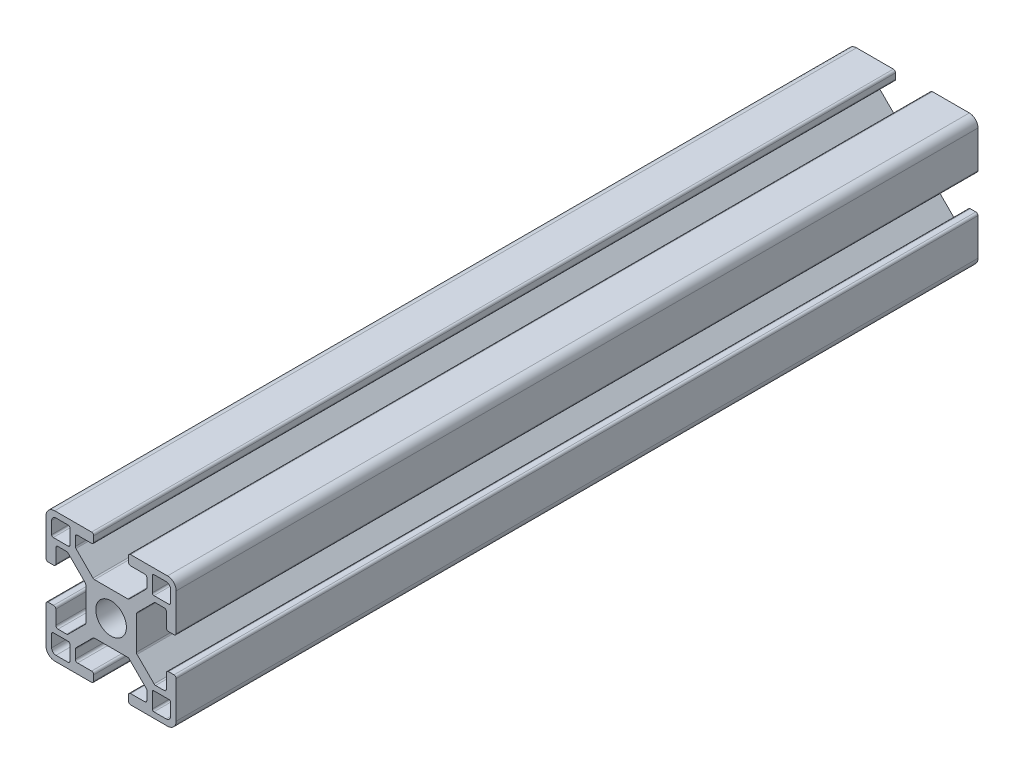
from build123d import *

# Parameters (mm, degrees)
SKETCH1_R           = 3.52998588
BOSS_EXTRUDE1_DEPTH = 92.4


with BuildPart() as part:
    # Sketch1 → Boss-Extrude1 (new, symmetric)
    with BuildSketch(Plane.XY):
        with BuildLine():
            Line((14.49994, -4), (13.24247465, -4))
            ThreePointArc((13.24247465, -4), (12.88892126, -4.146446609), (12.74247465, -4.5))
            Line((12.74247465, -4.5), (12.74247465, -7.732519321))
            ThreePointArc((12.74247465, -7.732519321), (12.602449697, -8.097296796), (12.242781236, -8.249967))
            Line((12.242781236, -8.249967), (10.260188032, -8.249967))
            ThreePointArc((10.260188032, -8.249967), (10.068847082, -8.211906919), (9.906636056, -8.103520976))
            Line((9.906636056, -8.103520976), (5.981117769, -4.178002689))
            ThreePointArc((5.981117769, -4.178002689), (5.872731827, -4.015791664), (5.834671745, -3.824450713))
            Line((5.834671745, -3.824450713), (5.834671745, -1.01249595))
            Line((5.834671745, -1.01249595), (5.834671745, 0.88749645))
            Line((5.834671745, 0.88749645), (5.834671745, 3.824450713))
            ThreePointArc((5.834671745, 3.824450713), (5.872731827, 4.015791664), (5.981117769, 4.178002689))
            Line((5.981117769, 4.178002689), (9.906636056, 8.103520976))
            ThreePointArc((9.906636056, 8.103520976), (10.068847082, 8.211906919), (10.260188032, 8.249967))
            Line((10.260188032, 8.249967), (12.242781236, 8.249967))
            ThreePointArc((12.242781236, 8.249967), (12.602449697, 8.097296796), (12.74247465, 7.732519321))
            Line((12.74247465, 7.732519321), (12.74247465, 4.5))
            ThreePointArc((12.74247465, 4.5), (12.88892126, 4.146446609), (13.24247465, 4))
            Line((13.24247465, 4), (14.49994, 4))
            ThreePointArc((14.49994, 4), (14.853493391, 4.146446609), (14.99994, 4.5))
            Line((14.99994, 4.5), (14.99994, 12.999948))
            ThreePointArc((14.99994, 12.999948), (14.414155906, 14.414155906), (12.999948, 14.99994))
            Line((12.999948, 14.99994), (4.5, 14.99994))
            ThreePointArc((4.5, 14.99994), (4.146446609, 14.853493391), (4, 14.49994))
            Line((4, 14.49994), (4, 13.24247465))
            ThreePointArc((4, 13.24247465), (4.146446609, 12.88892126), (4.5, 12.74247465))
            Line((4.5, 12.74247465), (7.732519321, 12.74247465))
            ThreePointArc((7.732519321, 12.74247465), (8.097296796, 12.602449697), (8.249967, 12.242781236))
            Line((8.249967, 12.242781236), (8.249967, 10.260188032))
            ThreePointArc((8.249967, 10.260188032), (8.211906919, 10.068847082), (8.103520976, 9.906636056))
            Line((8.103520976, 9.906636056), (4.178002689, 5.981117769))
            ThreePointArc((4.178002689, 5.981117769), (4.015791664, 5.872731827), (3.824450713, 5.834671745))
            Line((3.824450713, 5.834671745), (0.9499962, 5.834671745))
            Line((0.9499962, 5.834671745), (-0.9499962, 5.834671745))
            Line((-0.9499962, 5.834671745), (-3.824450713, 5.834671745))
            ThreePointArc((-3.824450713, 5.834671745), (-4.015791664, 5.872731827), (-4.178002689, 5.981117769))
            Line((-4.178002689, 5.981117769), (-8.103520976, 9.906636056))
            ThreePointArc((-8.103520976, 9.906636056), (-8.211906919, 10.068847082), (-8.249967, 10.260188032))
            Line((-8.249967, 10.260188032), (-8.249967, 12.242781236))
            ThreePointArc((-8.249967, 12.242781236), (-8.097296796, 12.602449697), (-7.732519321, 12.74247465))
            Line((-7.732519321, 12.74247465), (-4.5, 12.74247465))
            ThreePointArc((-4.5, 12.74247465), (-4.146446609, 12.88892126), (-4, 13.24247465))
            Line((-4, 13.24247465), (-4, 14.49994))
            ThreePointArc((-4, 14.49994), (-4.146446609, 14.853493391), (-4.5, 14.99994))
            Line((-4.5, 14.99994), (-12.999948, 14.99994))
            ThreePointArc((-12.999948, 14.99994), (-14.414155906, 14.414155906), (-14.99994, 12.999948))
            Line((-14.99994, 12.999948), (-14.99994, 4.5))
            ThreePointArc((-14.99994, 4.5), (-14.853493391, 4.146446609), (-14.49994, 4))
            Line((-14.49994, 4), (-13.24247465, 4))
            ThreePointArc((-13.24247465, 4), (-12.88892126, 4.146446609), (-12.74247465, 4.5))
            Line((-12.74247465, 4.5), (-12.74247465, 7.732519321))
            ThreePointArc((-12.74247465, 7.732519321), (-12.602449697, 8.097296796), (-12.242781236, 8.249967))
            Line((-12.242781236, 8.249967), (-10.260188032, 8.249967))
            ThreePointArc((-10.260188032, 8.249967), (-10.068847082, 8.211906919), (-9.906636056, 8.103520976))
            Line((-9.906636056, 8.103520976), (-5.981117769, 4.178002689))
            ThreePointArc((-5.981117769, 4.178002689), (-5.872731827, 4.015791664), (-5.834671745, 3.824450713))
            Line((-5.834671745, 3.824450713), (-5.834671745, 0.88749645))
            Line((-5.834671745, 0.88749645), (-5.834671745, -1.01249595))
            Line((-5.834671745, -1.01249595), (-5.834671745, -3.824450713))
            ThreePointArc((-5.834671745, -3.824450713), (-5.872731827, -4.015791664), (-5.981117769, -4.178002689))
            Line((-5.981117769, -4.178002689), (-9.906636056, -8.103520976))
            ThreePointArc((-9.906636056, -8.103520976), (-10.068847082, -8.211906919), (-10.260188032, -8.249967))
            Line((-10.260188032, -8.249967), (-12.242781236, -8.249967))
            ThreePointArc((-12.242781236, -8.249967), (-12.602449697, -8.097296796), (-12.74247465, -7.732519321))
            Line((-12.74247465, -7.732519321), (-12.74247465, -4.5))
            ThreePointArc((-12.74247465, -4.5), (-12.88892126, -4.146446609), (-13.24247465, -4))
            Line((-13.24247465, -4), (-14.49994, -4))
            ThreePointArc((-14.49994, -4), (-14.853493391, -4.146446609), (-14.99994, -4.5))
            Line((-14.99994, -4.5), (-14.99994, -12.999948))
            ThreePointArc((-14.99994, -12.999948), (-14.414155906, -14.414155906), (-12.999948, -14.99994))
            Line((-12.999948, -14.99994), (-4.5, -14.99994))
            ThreePointArc((-4.5, -14.99994), (-4.146446609, -14.853493391), (-4, -14.49994))
            Line((-4, -14.49994), (-4, -13.24247465))
            ThreePointArc((-4, -13.24247465), (-4.146446609, -12.88892126), (-4.5, -12.74247465))
            Line((-4.5, -12.74247465), (-7.732519321, -12.74247465))
            ThreePointArc((-7.732519321, -12.74247465), (-8.097296796, -12.602449697), (-8.249967, -12.242781236))
            Line((-8.249967, -12.242781236), (-8.249967, -10.260188032))
            ThreePointArc((-8.249967, -10.260188032), (-8.211906919, -10.068847082), (-8.103520976, -9.906636056))
            Line((-8.103520976, -9.906636056), (-4.178002689, -5.981117769))
            ThreePointArc((-4.178002689, -5.981117769), (-4.015791664, -5.872731827), (-3.824450713, -5.834671745))
            Line((-3.824450713, -5.834671745), (-0.9499962, -5.834671745))
            Line((-0.9499962, -5.834671745), (0.9499962, -5.834671745))
            Line((0.9499962, -5.834671745), (3.824450713, -5.834671745))
            ThreePointArc((3.824450713, -5.834671745), (4.015791664, -5.872731827), (4.178002689, -5.981117769))
            Line((4.178002689, -5.981117769), (8.103520976, -9.906636056))
            ThreePointArc((8.103520976, -9.906636056), (8.211906919, -10.068847082), (8.249967, -10.260188032))
            Line((8.249967, -10.260188032), (8.249967, -12.242781236))
            ThreePointArc((8.249967, -12.242781236), (8.097296796, -12.602449697), (7.732519321, -12.74247465))
            Line((7.732519321, -12.74247465), (4.5, -12.74247465))
            ThreePointArc((4.5, -12.74247465), (4.146446609, -12.88892126), (4, -13.24247465))
            Line((4, -13.24247465), (4, -14.49994))
            ThreePointArc((4, -14.49994), (4.146446609, -14.853493391), (4.5, -14.99994))
            Line((4.5, -14.99994), (12.999948, -14.99994))
            ThreePointArc((12.999948, -14.99994), (14.414155906, -14.414155906), (14.99994, -12.999948))
            Line((14.99994, -12.999948), (14.99994, -4.5))
            ThreePointArc((14.99994, -4.5), (14.853493391, -4.146446609), (14.49994, -4))
        make_face()
        Circle(SKETCH1_R, mode=Mode.SUBTRACT)
        with BuildLine():
            Line((-12.6999492, -13.6999452), (-9.880960476, -13.6999452))
            ThreePointArc((-9.880960476, -13.6999452), (-9.61155387, -13.58835333), (-9.499962, -13.318946724))
            Line((-9.499962, -13.318946724), (-9.499962, -9.87996048))
            ThreePointArc((-9.499962, -9.87996048), (-9.611260978, -9.611260978), (-9.87996048, -9.499962))
            Line((-9.87996048, -9.499962), (-13.318946724, -9.499962))
            ThreePointArc((-13.318946724, -9.499962), (-13.58835333, -9.61155387), (-13.6999452, -9.880960476))
            Line((-13.6999452, -9.880960476), (-13.6999452, -12.6999492))
            ThreePointArc((-13.6999452, -12.6999492), (-13.407053153, -13.407053153), (-12.6999492, -13.6999452))
        make_face(mode=Mode.SUBTRACT)
        with BuildLine():
            Line((13.6999452, -12.6999492), (13.6999452, -9.880960476))
            ThreePointArc((13.6999452, -9.880960476), (13.58835333, -9.61155387), (13.318946724, -9.499962))
            Line((13.318946724, -9.499962), (9.87996048, -9.499962))
            ThreePointArc((9.87996048, -9.499962), (9.611260978, -9.611260978), (9.499962, -9.87996048))
            Line((9.499962, -9.87996048), (9.499962, -13.318946724))
            ThreePointArc((9.499962, -13.318946724), (9.61155387, -13.58835333), (9.880960476, -13.6999452))
            Line((9.880960476, -13.6999452), (12.6999492, -13.6999452))
            ThreePointArc((12.6999492, -13.6999452), (13.407053153, -13.407053153), (13.6999452, -12.6999492))
        make_face(mode=Mode.SUBTRACT)
        with BuildLine():
            Line((9.87996048, 9.499962), (13.318946724, 9.499962))
            ThreePointArc((13.318946724, 9.499962), (13.58835333, 9.61155387), (13.6999452, 9.880960476))
            Line((13.6999452, 9.880960476), (13.6999452, 12.6999492))
            ThreePointArc((13.6999452, 12.6999492), (13.407053153, 13.407053153), (12.6999492, 13.6999452))
            Line((12.6999492, 13.6999452), (9.880960476, 13.6999452))
            ThreePointArc((9.880960476, 13.6999452), (9.61155387, 13.58835333), (9.499962, 13.318946724))
            Line((9.499962, 13.318946724), (9.499962, 9.87996048))
            ThreePointArc((9.499962, 9.87996048), (9.611260978, 9.611260978), (9.87996048, 9.499962))
        make_face(mode=Mode.SUBTRACT)
        with BuildLine():
            Line((-13.6999452, 12.6999492), (-13.6999452, 9.880960476))
            ThreePointArc((-13.6999452, 9.880960476), (-13.58835333, 9.61155387), (-13.318946724, 9.499962))
            Line((-13.318946724, 9.499962), (-9.87996048, 9.499962))
            ThreePointArc((-9.87996048, 9.499962), (-9.611260978, 9.611260978), (-9.499962, 9.87996048))
            Line((-9.499962, 9.87996048), (-9.499962, 13.318946724))
            ThreePointArc((-9.499962, 13.318946724), (-9.61155387, 13.58835333), (-9.880960476, 13.6999452))
            Line((-9.880960476, 13.6999452), (-12.6999492, 13.6999452))
            ThreePointArc((-12.6999492, 13.6999452), (-13.407053153, 13.407053153), (-13.6999452, 12.6999492))
        make_face(mode=Mode.SUBTRACT)
    extrude(amount=BOSS_EXTRUDE1_DEPTH, both=True)


solid = part.part
